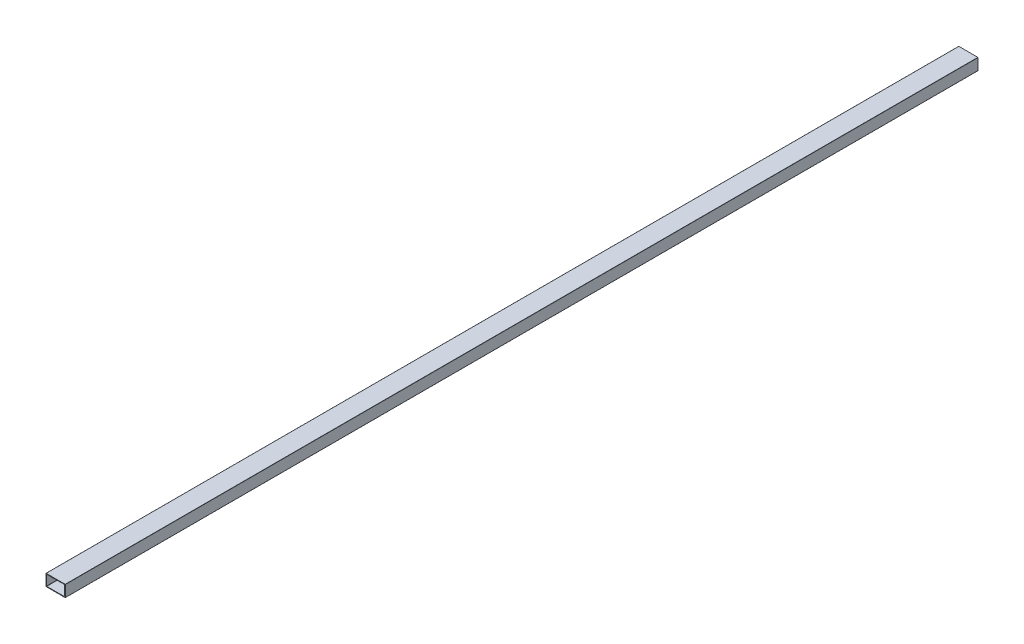
from build123d import *

# Parameters (mm, degrees)
CROQUIS1_W              = 127
CROQUIS1_H              = 76.2
CROQUIS1_W_2            = 119.4
CROQUIS1_H_2            = 68.6
SALIENTE_EXTRUIR1_DEPTH = 6000
REDONDEO1_R             = 1


with BuildPart() as part:
    # Croquis1 → Saliente-Extruir1 (new body)
    with BuildSketch(Plane.XY):
        Rectangle(CROQUIS1_W, CROQUIS1_H)
        Rectangle(CROQUIS1_W_2, CROQUIS1_H_2, mode=Mode.SUBTRACT)
    extrude(amount=-SALIENTE_EXTRUIR1_DEPTH)

    # Redondeo1
    redondeo1_edges = [part.edges().sort_by_distance(p)[0] for p in [
        (59.7, -34.3, -3000),
        (-59.7, -34.3, -3000),
        (-59.7, 34.3, -3000),
        (59.7, 34.3, -3000),
        (63.5, -38.1, -3000),
        (-63.5, -38.1, -3000),
        (-63.5, 38.1, -3000),
        (63.5, 38.1, -3000),
    ]]
    fillet(redondeo1_edges, radius=REDONDEO1_R)


solid = part.part
